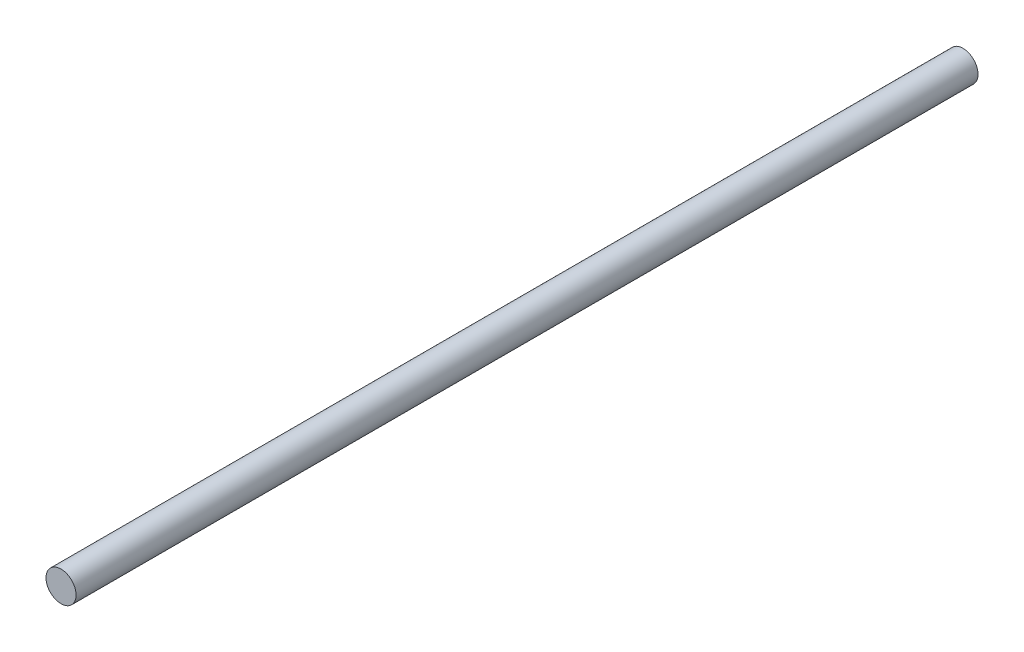
from build123d import *

# Parameters (mm, degrees)
SKETCH1_R           = 1
BOSS_EXTRUDE1_DEPTH = 45
CUT_EXTRUDE1_START  = -20
SKETCH2_R           = 1
CUT_EXTRUDE1_DEPTH  = 20
SKETCH3_R           = 1
BOSS_EXTRUDE2_DEPTH = 25
SKETCH4_R           = 1
BOSS_EXTRUDE3_DEPTH = 5
SKETCH5_R           = 1
BOSS_EXTRUDE4_DEPTH = 5


with BuildPart() as part:
    # Sketch1 → Boss-Extrude1 (new body)
    with BuildSketch(Plane.XY):
        with Locations(Location((0, 0, 0), (0, 0, 180))):
            Circle(SKETCH1_R)
    extrude(amount=BOSS_EXTRUDE1_DEPTH)

    # Sketch2 → Cut-Extrude1 (cut)
    with BuildSketch(Plane.XY.offset(45).offset(CUT_EXTRUDE1_START)):
        with Locations(Location((0, 0, 0), (0, 0, 180))):
            Circle(SKETCH2_R)
    extrude(amount=CUT_EXTRUDE1_DEPTH, mode=Mode.SUBTRACT)

    # Sketch3 → Boss-Extrude2 (add)
    with BuildSketch(Plane.XY.offset(25)):
        with Locations(Location((0, 0, 0), (0, 0, 180))):
            Circle(SKETCH3_R)
    extrude(amount=BOSS_EXTRUDE2_DEPTH)

    # Sketch4 → Boss-Extrude3 (add)
    with BuildSketch(Plane.XY.offset(50)):
        with Locations(Location((0, 0, 0), (0, 0, 180))):
            Circle(SKETCH4_R)
    extrude(amount=BOSS_EXTRUDE3_DEPTH)

    # Sketch5 → Boss-Extrude4 (add)
    with BuildSketch(Plane.XY.offset(55)):
        with Locations(Location((0, 0, 0), (0, 0, 180))):
            Circle(SKETCH5_R)
    extrude(amount=BOSS_EXTRUDE4_DEPTH)


solid = part.part
